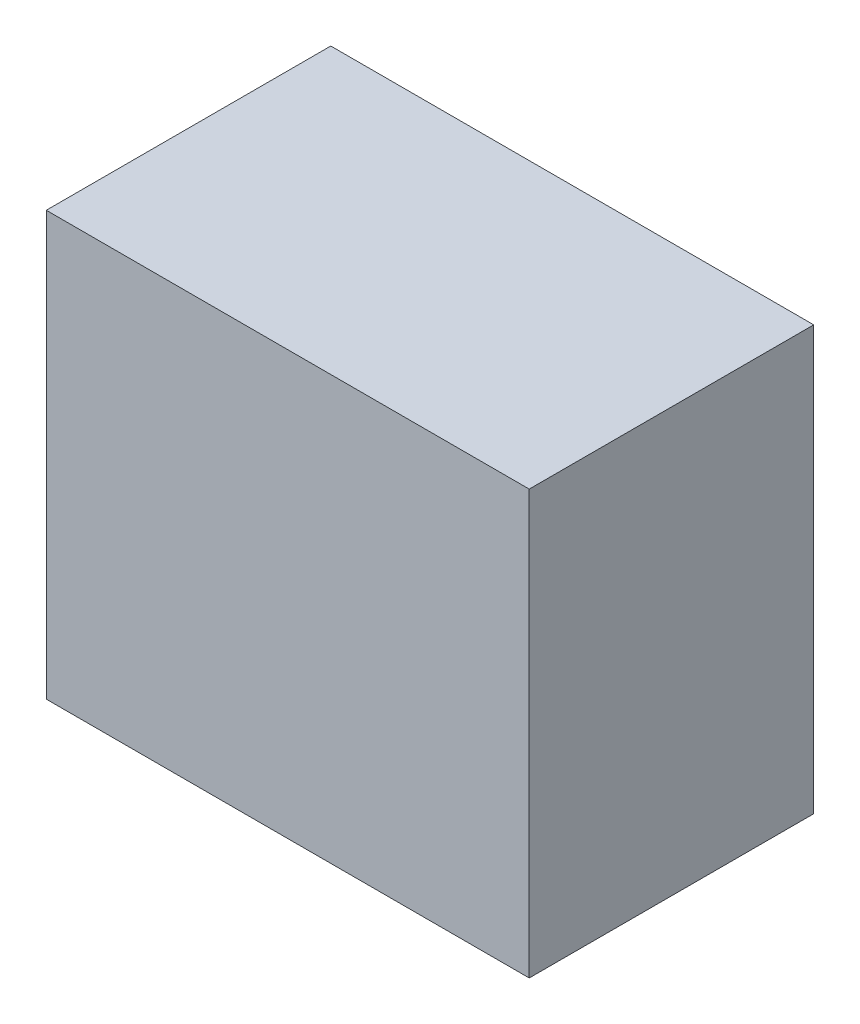
from build123d import *

# Parameters (mm, degrees)
SKETCH_2_W      = 73
SKETCH_2_H      = 64
EXTRUDE_1_DEPTH = 43


with BuildPart() as part:
    # 草图2 → 凸台-拉伸1 (new body)
    with BuildSketch(Plane.XY):
        Rectangle(SKETCH_2_W, SKETCH_2_H)
    extrude(amount=EXTRUDE_1_DEPTH)


solid = part.part
